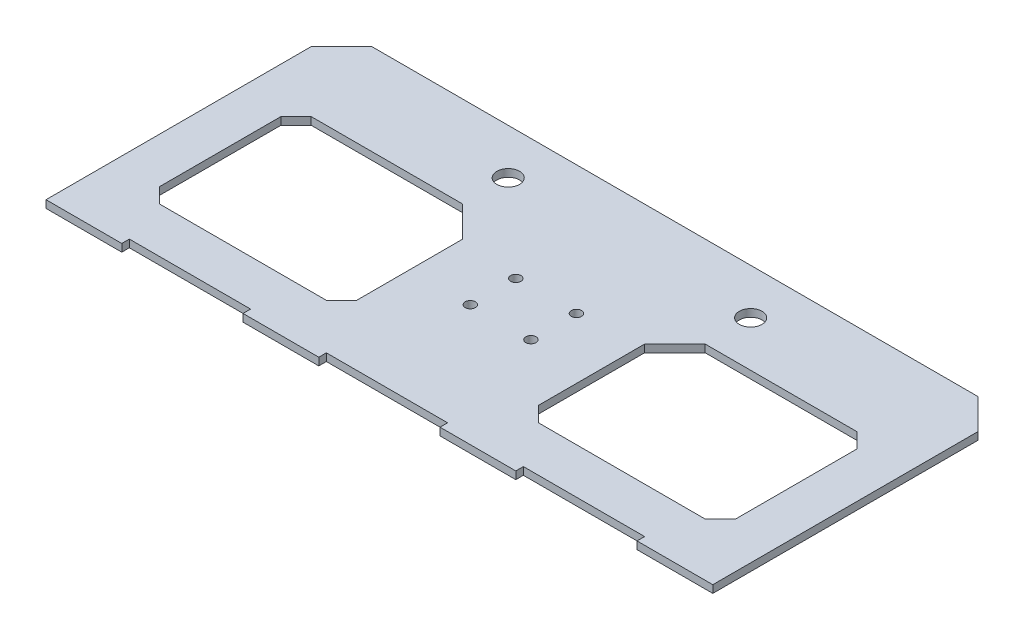
from build123d import *

# Parameters (mm, degrees)
ESQUISSE1_R             = 6.75
ESQUISSE1_R_2           = 15
BOSS_EXTRU_1_DEPTH      = 10
ENL_V_MAT_EXTRU_1_DEPTH = 10
CHANFREIN1_SIZE         = 40


with BuildPart() as part:
    # Esquisse1 → Boss.-Extru.1 (new body)
    with BuildSketch(Plane(origin=(0, 0, 0), x_dir=(1, 0, 0), z_dir=(0, 1, 0))):
        Polygon((0, 0), (0, 250), (240, 250), (320, 250), (560, 250), (640, 250), (880, 250), (880, 0), (880, -140), (780, -140), (780, -130), (620, -130), (620, -140), (520, -140), (520, -130), (360, -130), (360, -140), (260, -140), (260, -130), (100, -130), (100, -140), (0, -140), align=None)
        with Locations(Location((480, 20, 0), (0, 0, 270))):
            Circle(ESQUISSE1_R, mode=Mode.SUBTRACT)
        with Locations(Location((400, 20, 0), (0, 0, 270))):
            Circle(ESQUISSE1_R, mode=Mode.SUBTRACT)
        with Locations(Location((400, 80, 0), (0, 0, 270))):
            Circle(ESQUISSE1_R, mode=Mode.SUBTRACT)
        with Locations(Location((480, 80, 0), (0, 0, 270))):
            Circle(ESQUISSE1_R, mode=Mode.SUBTRACT)
        with Locations(Location((280, 190, 0), (0, 0, 270))):
            Circle(ESQUISSE1_R_2, mode=Mode.SUBTRACT)
        with Locations(Location((600, 190, 0), (0, 0, 270))):
            Circle(ESQUISSE1_R_2, mode=Mode.SUBTRACT)
    extrude(amount=BOSS_EXTRU_1_DEPTH)

    # Esquisse2 → Enlèv. mat.-Extru.1 (cut)
    with BuildSketch(Plane(origin=(0, 10, 0), x_dir=(1, 0, 0), z_dir=(0, 1, 0))):
        Polygon((800, 130), (600, 130), (560, 90), (560, -50), (580, -70), (800, -70), (820, -50), (820, 110), align=None)
        Polygon((80, 130), (60, 110), (60, -50), (80, -70), (300, -70), (320, -50), (320, 90), (280, 130), align=None)
    extrude(amount=-ENL_V_MAT_EXTRU_1_DEPTH, mode=Mode.SUBTRACT)

    # Chanfrein1
    chanfrein1_edges = [part.edges().sort_by_distance(p)[0] for p in [
        (0, 5, -250),
        (880, 5, -250),
    ]]
    chamfer(chanfrein1_edges, length=CHANFREIN1_SIZE)


solid = part.part
